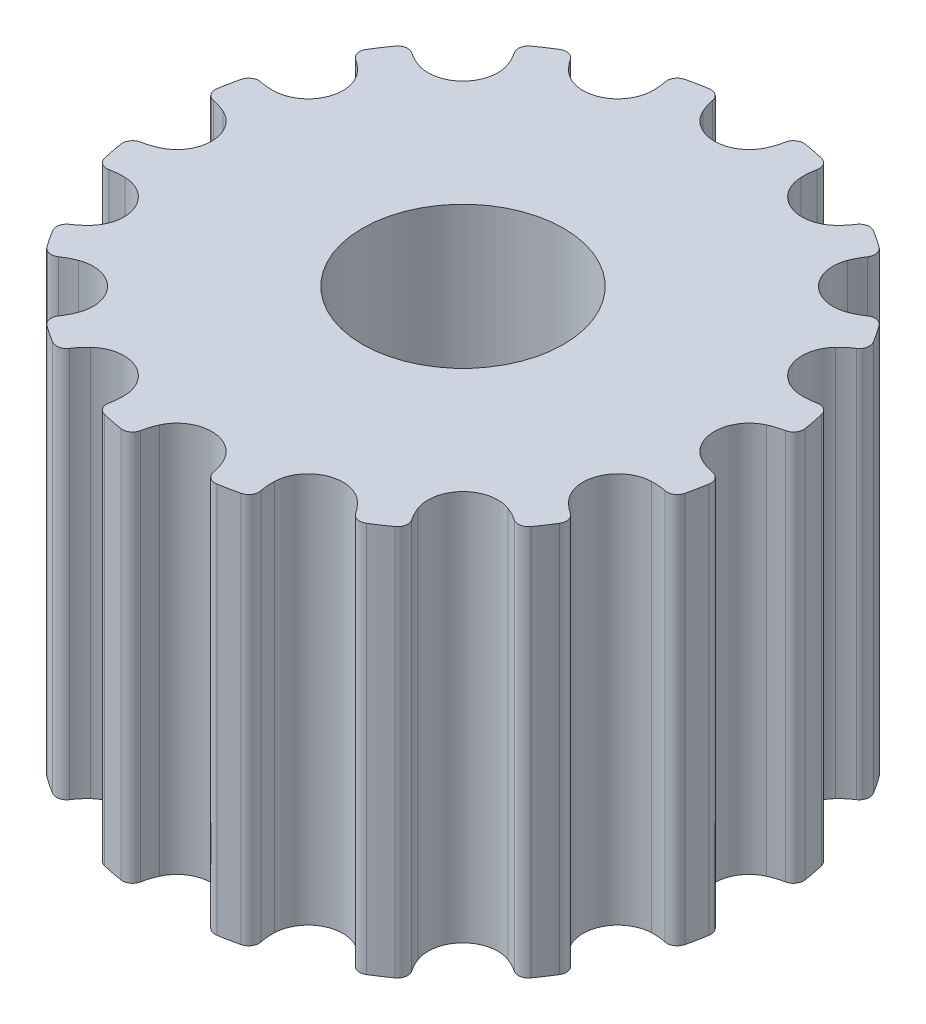
from build123d import *

# Parameters (mm, degrees)
SKETCH1_R           = 2.4511
BOSS_EXTRUDE1_DEPTH = 4.7625


with BuildPart() as part:
    # Sketch1 → Boss-Extrude1 (new, symmetric)
    with BuildSketch(Plane(origin=(0, 0, 0), x_dir=(1, 0, 0), z_dir=(0, 1, 0))):
        with BuildLine():
            ThreePointArc((-1.850768, -6.777037356), (-1.816941892, -6.962421006), (-1.663291889, -7.071521784))
            ThreePointArc((-1.663291889, -7.071521784), (-1.417233644, -7.124914669), (-1.169472895, -7.169748489))
            ThreePointArc((-1.169472895, -7.169748489), (-0.985767742, -7.127751824), (-0.883573242, -6.969424355))
            ThreePointArc((-0.883573242, -6.969424355), (-0.839120956, -6.792881518), (-0.773880597, -6.622919538))
            ThreePointArc((-0.773880597, -6.622919538), (0, -6.1245), (0.773880597, -6.622919538))
            ThreePointArc((0.773880597, -6.622919538), (0.839120956, -6.792881518), (0.883573242, -6.969424355))
            ThreePointArc((0.883573242, -6.969424355), (0.985767742, -7.127751824), (1.169472895, -7.169748489))
            ThreePointArc((1.169472895, -7.169748489), (1.417233644, -7.124914669), (1.663291889, -7.071521784))
            ThreePointArc((1.663291889, -7.071521784), (1.816941892, -6.962421006), (1.850768, -6.777037356))
            ThreePointArc((1.850768, -6.777037356), (1.824276538, -6.596921889), (1.819509137, -6.414931089))
            ThreePointArc((1.819509137, -6.414931089), (2.343744682, -5.658300197), (3.249454025, -5.822628523))
            ThreePointArc((3.249454025, -5.822628523), (3.374769892, -5.954686513), (3.483398468, -6.100779674))
            ThreePointArc((3.483398468, -6.100779674), (3.638403174, -6.20794704), (3.824196033, -6.176445981))
            ThreePointArc((3.824196033, -6.176445981), (4.035939958, -6.040210999), (4.242835561, -5.896719991))
            ThreePointArc((4.242835561, -5.896719991), (4.343038594, -5.737124705), (4.303346591, -5.552907854))
            ThreePointArc((4.303346591, -5.552907854), (4.209944466, -5.396640704), (4.135895098, -5.230327534))
            ThreePointArc((4.135895098, -5.230327534), (4.330675481, -4.330675481), (5.230327534, -4.135895098))
            ThreePointArc((5.230327534, -4.135895098), (5.396640704, -4.209944466), (5.552907854, -4.303346591))
            ThreePointArc((5.552907854, -4.303346591), (5.737124705, -4.343038594), (5.896719991, -4.242835561))
            ThreePointArc((5.896719991, -4.242835561), (6.040210999, -4.035939958), (6.176445981, -3.824196033))
            ThreePointArc((6.176445981, -3.824196033), (6.20794704, -3.638403174), (6.100779674, -3.483398468))
            ThreePointArc((6.100779674, -3.483398468), (5.954686513, -3.374769892), (5.822628523, -3.249454025))
            ThreePointArc((5.822628523, -3.249454025), (5.658300197, -2.343744682), (6.414931089, -1.819509137))
            ThreePointArc((6.414931089, -1.819509137), (6.596921889, -1.824276538), (6.777037356, -1.850768))
            ThreePointArc((6.777037356, -1.850768), (6.962421006, -1.816941892), (7.071521784, -1.663291889))
            ThreePointArc((7.071521784, -1.663291889), (7.124914669, -1.417233644), (7.169748489, -1.169472895))
            ThreePointArc((7.169748489, -1.169472895), (7.127751824, -0.985767742), (6.969424355, -0.883573242))
            ThreePointArc((6.969424355, -0.883573242), (6.792881518, -0.839120956), (6.622919538, -0.773880597))
            ThreePointArc((6.622919538, -0.773880597), (6.1245, 0), (6.622919538, 0.773880597))
            ThreePointArc((6.622919538, 0.773880597), (6.792881518, 0.839120956), (6.969424355, 0.883573242))
            ThreePointArc((6.969424355, 0.883573242), (7.127751824, 0.985767742), (7.169748489, 1.169472895))
            ThreePointArc((7.169748489, 1.169472895), (7.124914669, 1.417233644), (7.071521784, 1.663291889))
            ThreePointArc((7.071521784, 1.663291889), (6.962421006, 1.816941892), (6.777037356, 1.850768))
            ThreePointArc((6.777037356, 1.850768), (6.596921889, 1.824276538), (6.414931089, 1.819509137))
            ThreePointArc((6.414931089, 1.819509137), (5.658300197, 2.343744682), (5.822628523, 3.249454025))
            ThreePointArc((5.822628523, 3.249454025), (5.954686513, 3.374769892), (6.100779674, 3.483398468))
            ThreePointArc((6.100779674, 3.483398468), (6.20794704, 3.638403174), (6.176445981, 3.824196033))
            ThreePointArc((6.176445981, 3.824196033), (6.040210999, 4.035939958), (5.896719991, 4.242835561))
            ThreePointArc((5.896719991, 4.242835561), (5.737124705, 4.343038594), (5.552907854, 4.303346591))
            ThreePointArc((5.552907854, 4.303346591), (5.396640704, 4.209944466), (5.230327534, 4.135895098))
            ThreePointArc((5.230327534, 4.135895098), (4.330675481, 4.330675481), (4.135895098, 5.230327534))
            ThreePointArc((4.135895098, 5.230327534), (4.209944466, 5.396640704), (4.303346591, 5.552907854))
            ThreePointArc((4.303346591, 5.552907854), (4.343038594, 5.737124705), (4.242835561, 5.896719991))
            ThreePointArc((4.242835561, 5.896719991), (4.035939958, 6.040210999), (3.824196033, 6.176445981))
            ThreePointArc((3.824196033, 6.176445981), (3.638403174, 6.20794704), (3.483398468, 6.100779674))
            ThreePointArc((3.483398468, 6.100779674), (3.374769892, 5.954686513), (3.249454025, 5.822628523))
            ThreePointArc((3.249454025, 5.822628523), (2.343744682, 5.658300197), (1.819509137, 6.414931089))
            ThreePointArc((1.819509137, 6.414931089), (1.824276538, 6.596921889), (1.850768, 6.777037356))
            ThreePointArc((1.850768, 6.777037356), (1.816941892, 6.962421006), (1.663291889, 7.071521784))
            ThreePointArc((1.663291889, 7.071521784), (1.417233644, 7.124914669), (1.169472895, 7.169748489))
            ThreePointArc((1.169472895, 7.169748489), (0.985767742, 7.127751824), (0.883573242, 6.969424355))
            ThreePointArc((0.883573242, 6.969424355), (0.839120956, 6.792881518), (0.773880597, 6.622919538))
            ThreePointArc((0.773880597, 6.622919538), (0, 6.1245), (-0.773880597, 6.622919538))
            ThreePointArc((-0.773880597, 6.622919538), (-0.839120956, 6.792881518), (-0.883573242, 6.969424355))
            ThreePointArc((-0.883573242, 6.969424355), (-0.985767742, 7.127751824), (-1.169472895, 7.169748489))
            ThreePointArc((-1.169472895, 7.169748489), (-1.417233644, 7.124914669), (-1.663291889, 7.071521784))
            ThreePointArc((-1.663291889, 7.071521784), (-1.816941892, 6.962421006), (-1.850768, 6.777037356))
            ThreePointArc((-1.850768, 6.777037356), (-1.824276538, 6.596921889), (-1.819509137, 6.414931089))
            ThreePointArc((-1.819509137, 6.414931089), (-2.343744682, 5.658300197), (-3.249454025, 5.822628523))
            ThreePointArc((-3.249454025, 5.822628523), (-3.374769892, 5.954686513), (-3.483398468, 6.100779674))
            ThreePointArc((-3.483398468, 6.100779674), (-3.638403174, 6.20794704), (-3.824196033, 6.176445981))
            ThreePointArc((-3.824196033, 6.176445981), (-4.035939958, 6.040210999), (-4.242835561, 5.896719991))
            ThreePointArc((-4.242835561, 5.896719991), (-4.343038594, 5.737124705), (-4.303346591, 5.552907854))
            ThreePointArc((-4.303346591, 5.552907854), (-4.209944466, 5.396640704), (-4.135895098, 5.230327534))
            ThreePointArc((-4.135895098, 5.230327534), (-4.330675481, 4.330675481), (-5.230327534, 4.135895098))
            ThreePointArc((-5.230327534, 4.135895098), (-5.396640704, 4.209944466), (-5.552907854, 4.303346591))
            ThreePointArc((-5.552907854, 4.303346591), (-5.737124705, 4.343038594), (-5.896719991, 4.242835561))
            ThreePointArc((-5.896719991, 4.242835561), (-6.040210999, 4.035939958), (-6.176445981, 3.824196033))
            ThreePointArc((-6.176445981, 3.824196033), (-6.20794704, 3.638403174), (-6.100779674, 3.483398468))
            ThreePointArc((-6.100779674, 3.483398468), (-5.954686513, 3.374769892), (-5.822628523, 3.249454025))
            ThreePointArc((-5.822628523, 3.249454025), (-5.658300197, 2.343744682), (-6.414931089, 1.819509137))
            ThreePointArc((-6.414931089, 1.819509137), (-6.596921889, 1.824276538), (-6.777037356, 1.850768))
            ThreePointArc((-6.777037356, 1.850768), (-6.962421006, 1.816941892), (-7.071521784, 1.663291889))
            ThreePointArc((-7.071521784, 1.663291889), (-7.124914669, 1.417233644), (-7.169748489, 1.169472895))
            ThreePointArc((-7.169748489, 1.169472895), (-7.127751824, 0.985767742), (-6.969424355, 0.883573242))
            ThreePointArc((-6.969424355, 0.883573242), (-6.792881518, 0.839120956), (-6.622919538, 0.773880597))
            ThreePointArc((-6.622919538, 0.773880597), (-6.1245, 0), (-6.622919538, -0.773880597))
            ThreePointArc((-6.622919538, -0.773880597), (-6.792881518, -0.839120956), (-6.969424355, -0.883573242))
            ThreePointArc((-6.969424355, -0.883573242), (-7.127751824, -0.985767742), (-7.169748489, -1.169472895))
            ThreePointArc((-7.169748489, -1.169472895), (-7.124914669, -1.417233644), (-7.071521784, -1.663291889))
            ThreePointArc((-7.071521784, -1.663291889), (-6.962421006, -1.816941892), (-6.777037356, -1.850768))
            ThreePointArc((-6.777037356, -1.850768), (-6.596921889, -1.824276538), (-6.414931089, -1.819509137))
            ThreePointArc((-6.414931089, -1.819509137), (-5.658300197, -2.343744682), (-5.822628523, -3.249454025))
            ThreePointArc((-5.822628523, -3.249454025), (-5.954686513, -3.374769892), (-6.100779674, -3.483398468))
            ThreePointArc((-6.100779674, -3.483398468), (-6.20794704, -3.638403174), (-6.176445981, -3.824196033))
            ThreePointArc((-6.176445981, -3.824196033), (-6.040210999, -4.035939958), (-5.896719991, -4.242835561))
            ThreePointArc((-5.896719991, -4.242835561), (-5.737124705, -4.343038594), (-5.552907854, -4.303346591))
            ThreePointArc((-5.552907854, -4.303346591), (-5.396640704, -4.209944466), (-5.230327534, -4.135895098))
            ThreePointArc((-5.230327534, -4.135895098), (-4.330675481, -4.330675481), (-4.135895098, -5.230327534))
            ThreePointArc((-4.135895098, -5.230327534), (-4.209944466, -5.396640704), (-4.303346591, -5.552907854))
            ThreePointArc((-4.303346591, -5.552907854), (-4.343038594, -5.737124705), (-4.242835561, -5.896719991))
            ThreePointArc((-4.242835561, -5.896719991), (-4.035939958, -6.040210999), (-3.824196033, -6.176445981))
            ThreePointArc((-3.824196033, -6.176445981), (-3.638403174, -6.20794704), (-3.483398468, -6.100779674))
            ThreePointArc((-3.483398468, -6.100779674), (-3.374769892, -5.954686513), (-3.249454025, -5.822628523))
            ThreePointArc((-3.249454025, -5.822628523), (-2.343744682, -5.658300197), (-1.819509137, -6.414931089))
            ThreePointArc((-1.819509137, -6.414931089), (-1.824276538, -6.596921889), (-1.850768, -6.777037356))
        make_face()
        with Locations(Location((0, 0, 0), (0, 0, 90))):
            Circle(SKETCH1_R, mode=Mode.SUBTRACT)
    extrude(amount=BOSS_EXTRUDE1_DEPTH, both=True)


solid = part.part
